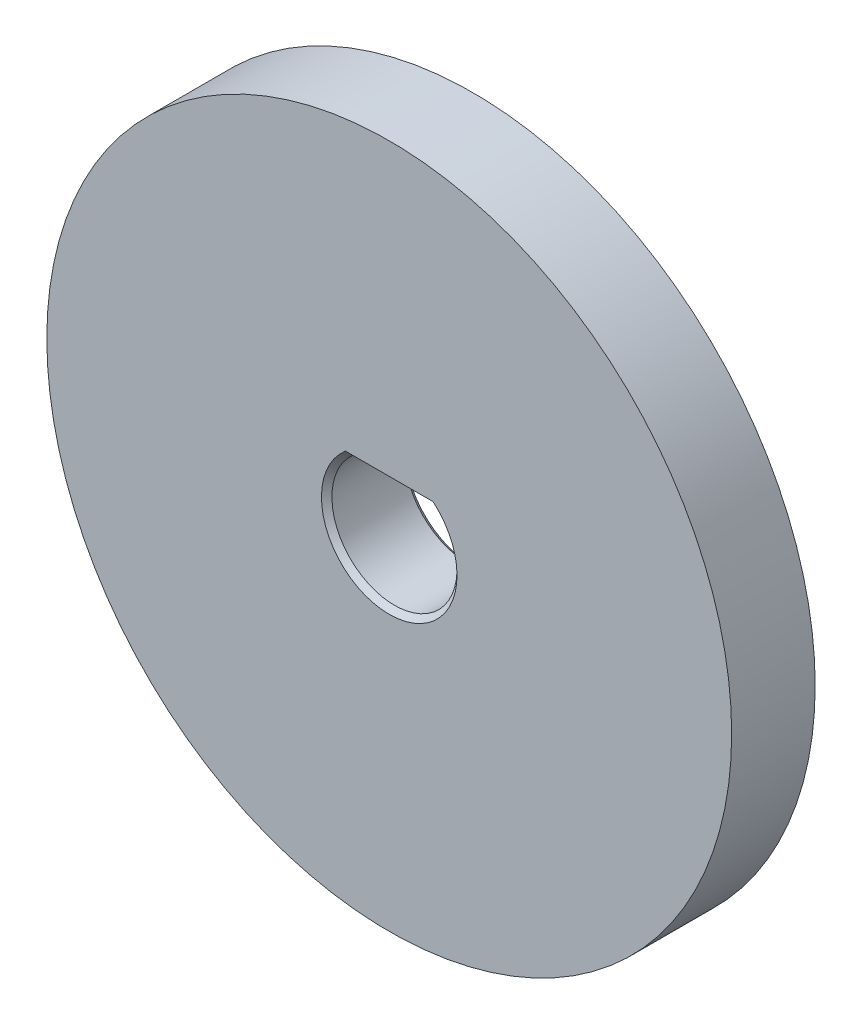
from build123d import *

# Parameters (mm, degrees)
SKETCH1_R           = 52.07
SKETCH1_R_2         = 9.5123
EXTRUDE1_DEPTH      = 6.35
BOSS_EXTRUDE1_DEPTH = 12.7
CHAMFER3_SIZE       = 0.79502


with BuildPart() as part:
    # Sketch1 → Extrude1 (new, symmetric)
    with BuildSketch(Plane.XY):
        Circle(SKETCH1_R)
        Circle(SKETCH1_R_2, mode=Mode.SUBTRACT)
    extrude(amount=EXTRUDE1_DEPTH, both=True)

    # Sketch3 → Boss-Extrude1 (add)
    with BuildSketch(Plane(origin=(0, 0, -6.35), x_dir=(-1, 0, 0), z_dir=(0, 0, -1))):
        with BuildLine():
            Line((-6.359543229, 7.0739), (6.359543229, 7.0739))
            ThreePointArc((6.359543229, 7.0739), (0, 9.5123), (-6.359543229, 7.0739))
        make_face()
    extrude(amount=-BOSS_EXTRUDE1_DEPTH)

    # Chamfer3
    chamfer3_edges = [part.edges().sort_by_distance(p)[0] for p in [
        (0, -9.5123, -6.35),
        (0, 7.0739, -6.35),
        (0, 7.0739, 6.35),
        (0, -9.5123, 6.35),
    ]]
    chamfer(chamfer3_edges, length=CHAMFER3_SIZE)


solid = part.part
